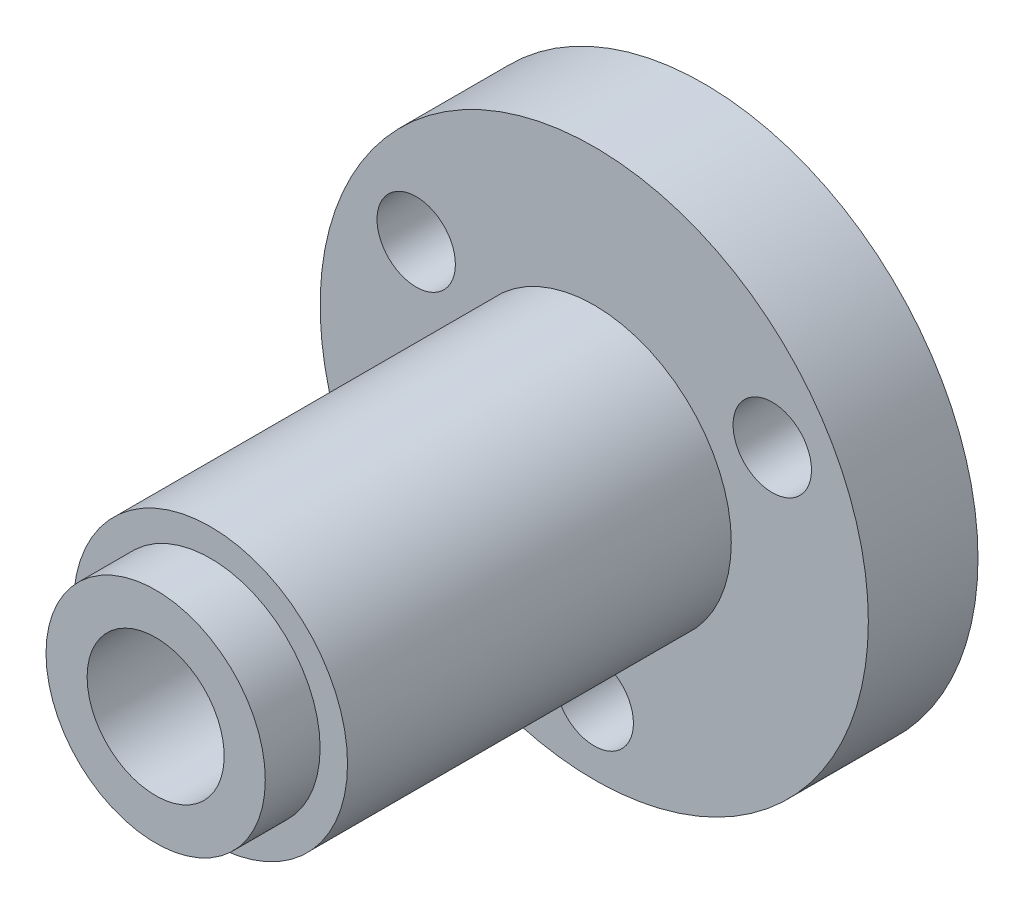
from build123d import *

# Parameters (mm, degrees)
SKETCH1_R           = 12.7
SKETCH1_R_2         = 1.8161
BOSS_EXTRUDE1_DEPTH = 2.54
SKETCH2_R           = 6.35
BOSS_EXTRUDE2_DEPTH = 20.32
SKETCH4_R           = 3.175
CUT_EXTRUDE1_DEPTH  = 37.061067996
CUT_EXTRUDE2_START  = -2.54
SKETCH5_R           = 6.35
SKETCH5_R_2         = 5.08
CUT_EXTRUDE2_DEPTH  = 2.54


with BuildPart() as part:
    # Sketch1 → Boss-Extrude1 (new, symmetric)
    with BuildSketch(Plane.XY):
        with Locations((0, 9.525)):
            Circle(SKETCH1_R)
        Circle(SKETCH1_R_2, mode=Mode.SUBTRACT)
        with Locations((-8.248891971, 14.2875)):
            Circle(SKETCH1_R_2, mode=Mode.SUBTRACT)
        with Locations((8.248891971, 14.2875)):
            Circle(SKETCH1_R_2, mode=Mode.SUBTRACT)
    extrude(amount=BOSS_EXTRUDE1_DEPTH, both=True)

    # Sketch2 → Boss-Extrude2 (add)
    with BuildSketch(Plane.XY.offset(2.54)):
        with Locations((0, 9.525)):
            Circle(SKETCH2_R)
    extrude(amount=BOSS_EXTRUDE2_DEPTH)

    # Sketch4 → Cut-Extrude1 (cut, through all)
    with BuildSketch(Plane(origin=(0, 0, -2.54), x_dir=(-1, 0, 0), z_dir=(0, 0, -1))):
        with Locations((0, 9.525)):
            Circle(SKETCH4_R)
    extrude(amount=-CUT_EXTRUDE1_DEPTH, mode=Mode.SUBTRACT)

    # Sketch5 → Cut-Extrude2 (cut)
    with BuildSketch(Plane.XY.offset(22.86).offset(CUT_EXTRUDE2_START)):
        with Locations((0, 9.525)):
            Circle(SKETCH5_R)
        with Locations((0, 9.525)):
            Circle(SKETCH5_R_2, mode=Mode.SUBTRACT)
    extrude(amount=CUT_EXTRUDE2_DEPTH, mode=Mode.SUBTRACT)


solid = part.part
